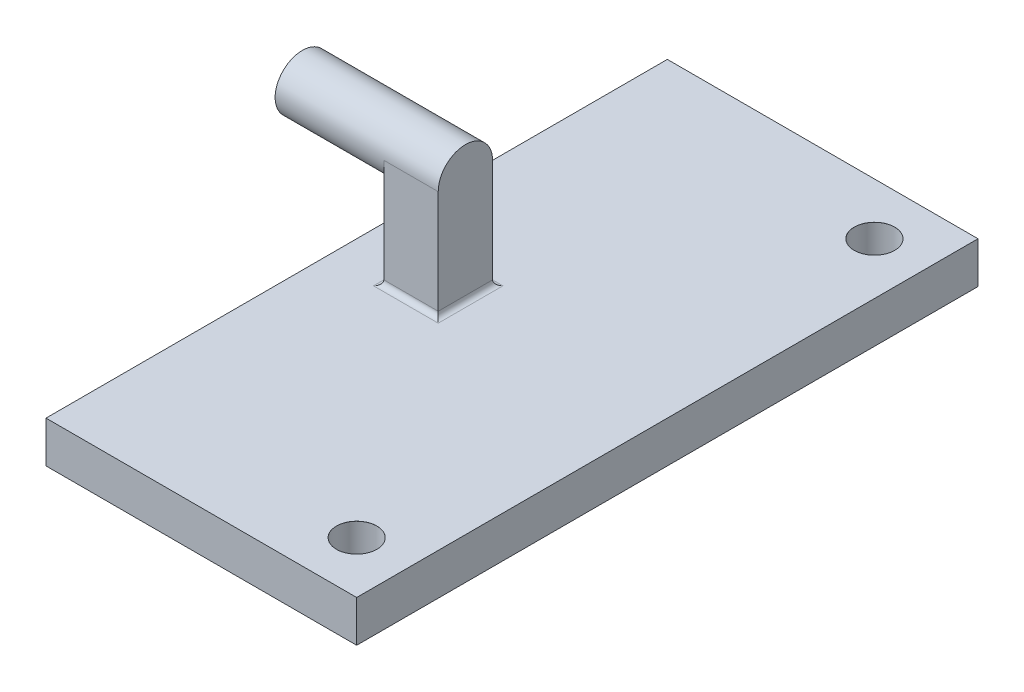
from build123d import *

# Parameters (mm, degrees)
SKETCH1_R                              = 26.25
BOSS_EXTRUDE1_DEPTH                    = 105
BOSS_EXTRUDE2_DEPTH                    = 52.5
TAP_DRILL_FOR_M24X2_0_TAP1_D           = 22
TAP_DRILL_FOR_M24X2_0_TAP1_DEPTH       = 105
TAP_DRILL_FOR_M24X2_0_TAP1_CSINK_D     = 22.05
TAP_DRILL_FOR_M24X2_0_TAP1_CSINK_ANGLE = 90
TAP_DRILL_FOR_M24X2_0_TAP1_TIP         = 6.609466809
BOSS_EXTRUDE3_DEPTH                    = 40
FILLET1_R                              = 5
TAP_DRILL_FOR_M42X3_0_TAP1_D           = 39
TAP_DRILL_FOR_M42X3_0_TAP1_CSINK_D     = 39.05
TAP_DRILL_FOR_M42X3_0_TAP1_CSINK_ANGLE = 90


with BuildPart() as part:
    # Sketch1 → Boss-Extrude1 (new body)
    with BuildSketch(Plane(origin=(0, 0, 0), x_dir=(0, 0, -1), z_dir=(1, 0, 0))):
        Circle(SKETCH1_R)
    extrude(amount=BOSS_EXTRUDE1_DEPTH)

    # Sketch2 → Boss-Extrude2 (add)
    with BuildSketch(Plane(origin=(105, 0, 0), x_dir=(0, 0, -1), z_dir=(1, 0, 0))):
        with BuildLine():
            Line((-26.25, 0), (-26.25, -105))
            Line((-26.25, -105), (26.25, -105))
            Line((26.25, -105), (26.25, 0))
            ThreePointArc((26.25, 0), (0, 26.25), (-26.25, 0))
        make_face()
    extrude(amount=BOSS_EXTRUDE2_DEPTH)

    # Tap Drill for M24x2.0 Tap1
    with Locations(Plane.ZY):
        with Locations((0, 0)):
            CounterSinkHole(TAP_DRILL_FOR_M24X2_0_TAP1_D / 2, TAP_DRILL_FOR_M24X2_0_TAP1_CSINK_D / 2, depth=TAP_DRILL_FOR_M24X2_0_TAP1_DEPTH, counter_sink_angle=TAP_DRILL_FOR_M24X2_0_TAP1_CSINK_ANGLE)
            with Locations((0, 0, -(TAP_DRILL_FOR_M24X2_0_TAP1_DEPTH + TAP_DRILL_FOR_M24X2_0_TAP1_TIP / 2))):  # 118° drill point
                Cone(0, TAP_DRILL_FOR_M24X2_0_TAP1_D / 2, TAP_DRILL_FOR_M24X2_0_TAP1_TIP, mode=Mode.SUBTRACT)

    # Sketch7 → Boss-Extrude3 (add)
    with BuildSketch(Plane.XZ.offset(105)):
        Polygon((52.5, 300), (352.5, 300), (352.5, -300), (52.5, -300), (52.5, 0), align=None)
    extrude(amount=BOSS_EXTRUDE3_DEPTH)

    # Fillet1
    fillet1_edges = [part.edges().sort_by_distance(p)[0] for p in [
        (105, -105, 0),
        (131.25, -105, 26.25),
        (131.25, -105, -26.25),
        (157.5, -105, 0),
    ]]
    fillet(fillet1_edges, radius=FILLET1_R)

    # Tap Drill for M42x3.0 Tap1 (through all)
    with Locations(Plane(origin=(0, -105, 0), x_dir=(1, 0, 0), z_dir=(0, 1, 0))):
        with Locations((302.5, -250), (302.5, 250)):
            CounterSinkHole(TAP_DRILL_FOR_M42X3_0_TAP1_D / 2, TAP_DRILL_FOR_M42X3_0_TAP1_CSINK_D / 2, counter_sink_angle=TAP_DRILL_FOR_M42X3_0_TAP1_CSINK_ANGLE)


solid = part.part
